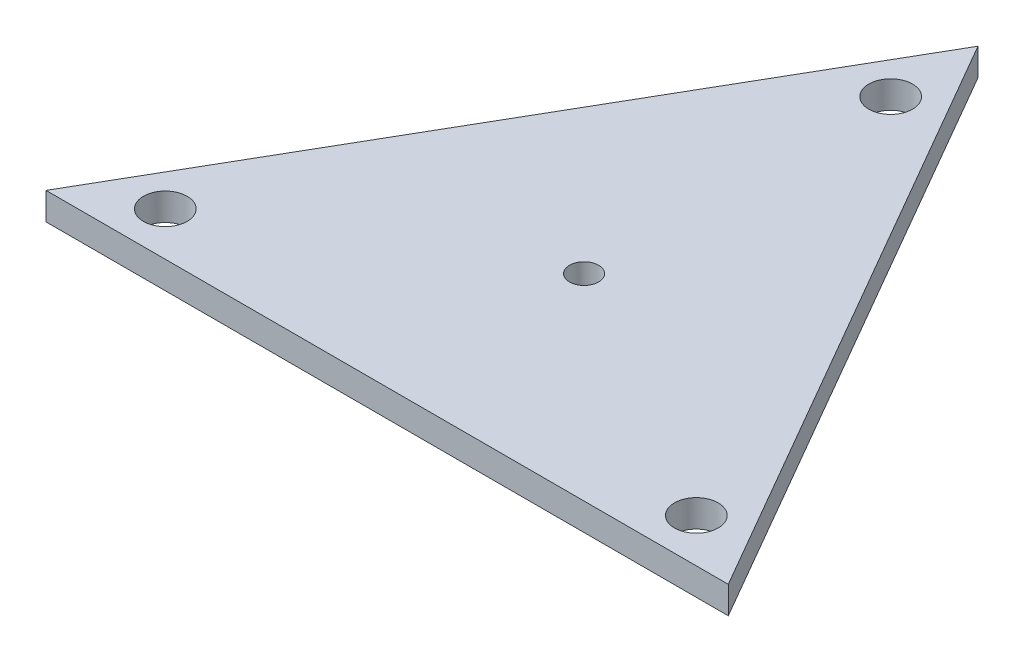
from build123d import *

# Parameters (mm, degrees)
BOSS_EXTRUDE1_DEPTH     = 5
CUT_EXTRUDE1_DEPTH      = 126.099960032
CUT_EXTRUDE1_DEPTH_BACK = 126.099960032
SKETCH2_R               = 4
SKETCH2_R_2             = 2.665209895


with BuildPart() as part:
    # Sketch1 → Boss-Extrude1 (new body)
    with BuildSketch(Plane(origin=(0, 0, 0), x_dir=(1, 0, 0), z_dir=(0, 1, 0))):
        Polygon((0, 108.253175473), (62.5, 0), (-62.5, 0), align=None)
    extrude(amount=BOSS_EXTRUDE1_DEPTH)

    # Sketch2 → Cut-Extrude1 (cut, two sides: drawn at the far end of the back side and taken through both)
    with BuildSketch(Plane(origin=(0, 5, 0), x_dir=(1, 0, 0), z_dir=(0, 1, 0)).offset(-CUT_EXTRUDE1_DEPTH_BACK)):
        with Locations(Location((-48.643593539, 8, 0), (0, 0, 270))):
            Circle(SKETCH2_R)
        with Locations(Location((48.643593539, 8, 0), (0, 0, 270))):
            Circle(SKETCH2_R)
        with Locations(Location((0, 92.253175473, 0), (0, 0, 270))):
            Circle(SKETCH2_R)
        with Locations(Location((0, 36.084391824, 0), (0, 0, 270))):
            Circle(SKETCH2_R_2)
    extrude(amount=CUT_EXTRUDE1_DEPTH + CUT_EXTRUDE1_DEPTH_BACK, mode=Mode.SUBTRACT)


solid = part.part
